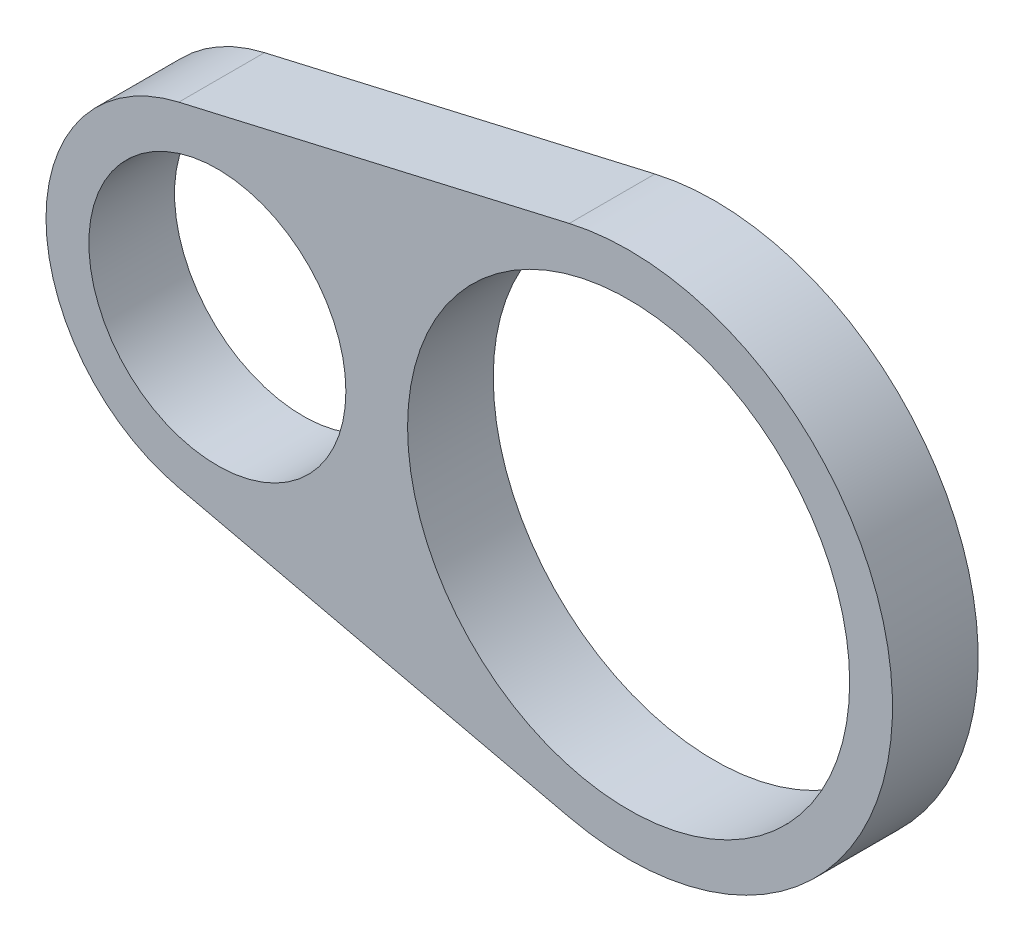
from build123d import *

# Parameters (mm, degrees)
ESBO_O2_R                = 15
ESBO_O2_R_2              = 25.8
RESSALTO_EXTRUS_O1_DEPTH = 10


with BuildPart() as part:
    # Esboço2 → Ressalto-extrusão1 (new body)
    with BuildSketch(Plane.XY):
        with BuildLine():
            Line((17.07, 30.010249916), (-28.5, 19.48717527))
            ThreePointArc((-28.5, 19.48717527), (-44, 0), (-28.5, -19.48717527))
            Line((-28.5, -19.48717527), (17.07, -30.010249916))
            ThreePointArc((17.07, -30.010249916), (54.8, 0), (17.07, 30.010249916))
        make_face()
        with Locations((-24, 0)):
            Circle(ESBO_O2_R, mode=Mode.SUBTRACT)
        with Locations((24, 0)):
            Circle(ESBO_O2_R_2, mode=Mode.SUBTRACT)
    extrude(amount=RESSALTO_EXTRUS_O1_DEPTH)


solid = part.part
